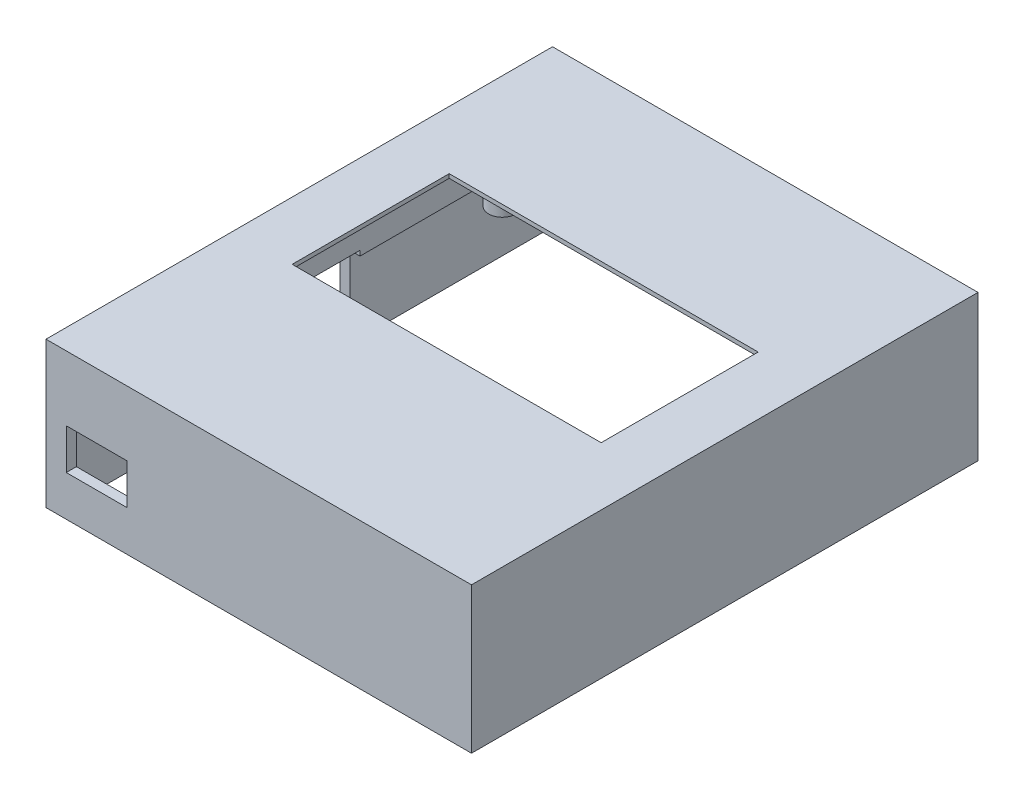
from build123d import *

# Parameters (mm, degrees)
SKETCH_1_W             = 42
SKETCH_1_H             = 50
BODY_DEPTH             = 0.4
SKETCH_3_R             = 1.35
OLED_PILLAR_DEPTH      = 5
OLED_WINDOW_REACH      = 35.093
SKETCH_2_W             = 30.5
SKETCH_2_H             = 15.5
SKETCH_4_W             = 42
SKETCH_4_H             = 50
SKETCH_4_W_2           = 40
SKETCH_4_H_2           = 48
FARMFEELWALL_DEPTH     = 14
SKETCH_5_W             = 1
SKETCH_5_H             = 42.1
SKETCH_5_H_2           = 48
ESPSUPPORT_DEPTH       = 6
MICRO5PIN_WINDOW_REACH = 52.843
SKETCH_7_W             = 13
SKETCH_7_H             = 6
RESET_WINDOW_REACH     = 58.009
SKETCH_9_W             = 6
SKETCH_9_H             = 4


with BuildPart() as part:
    # 스케치1 → Body (new body)
    with BuildSketch(Plane(origin=(0, 0, 0), x_dir=(1, 0, 0), z_dir=(0, 1, 0))):
        Rectangle(SKETCH_1_W, SKETCH_1_H)
    extrude(amount=BODY_DEPTH)

    # 스케치3 → OLED_pillar (add)
    with BuildSketch(Plane.XZ):
        with Locations(Location((15.25, 14.3, 0), (0, 0, 90))):
            Circle(SKETCH_3_R)
        with Locations(Location((-15.25, -14.3, 0), (0, 0, 90))):
            Circle(SKETCH_3_R)
    extrude(amount=OLED_PILLAR_DEPTH)

    # 스케치2 → OLED_window (cut, up to next)
    with BuildSketch(Plane(origin=(0, 0.4, 0), x_dir=(1, 0, 0), z_dir=(0, 1, 0)), mode=Mode.PRIVATE) as oled_window_sk1:
        with Locations((0, 1.3)):
            Rectangle(SKETCH_2_W, SKETCH_2_H)
    oled_window_tool1 = extrude(oled_window_sk1.sketch, amount=-OLED_WINDOW_REACH, mode=Mode.PRIVATE) & part.part
    add(oled_window_tool1.solids().sort_by_distance((0, 0.4, -1.3))[0], mode=Mode.SUBTRACT)

    # 스케치4 → FarmFeelWall (add)
    with BuildSketch(Plane.XZ):
        Rectangle(SKETCH_4_W, SKETCH_4_H)
        Rectangle(SKETCH_4_W_2, SKETCH_4_H_2, mode=Mode.SUBTRACT)
    extrude(amount=FARMFEELWALL_DEPTH)

    # 스케치5 → EspSupport (add)
    with BuildSketch(Plane.XZ):
        with Locations((-19.5, -2.95)):
            Rectangle(SKETCH_5_W, SKETCH_5_H)
        with Locations((19.5, 0)):
            Rectangle(SKETCH_5_W, SKETCH_5_H_2)
    extrude(amount=ESPSUPPORT_DEPTH)

    # 스케치7 → micro5pin_window (cut, up to next)
    with BuildSketch(Plane.ZY.offset(21), mode=Mode.PRIVATE) as micro5pin_window_sk1:
        with Locations((2.5, -8.5)):
            Rectangle(SKETCH_7_W, SKETCH_7_H)
    micro5pin_window_tool1 = extrude(micro5pin_window_sk1.sketch, amount=-MICRO5PIN_WINDOW_REACH, mode=Mode.PRIVATE) & part.part
    add(micro5pin_window_tool1.solids().sort_by_distance((-21, -8.5, 2.5))[0], mode=Mode.SUBTRACT)

    # 스케치9 → reset_window (cut, up to next)
    with BuildSketch(Plane.XY.offset(25), mode=Mode.PRIVATE) as reset_window_sk1:
        with Locations((-16, -8)):
            Rectangle(SKETCH_9_W, SKETCH_9_H)
    reset_window_tool1 = extrude(reset_window_sk1.sketch, amount=-RESET_WINDOW_REACH, mode=Mode.PRIVATE) & part.part
    add(reset_window_tool1.solids().sort_by_distance((-16, -8, 25))[0], mode=Mode.SUBTRACT)


solid = part.part
